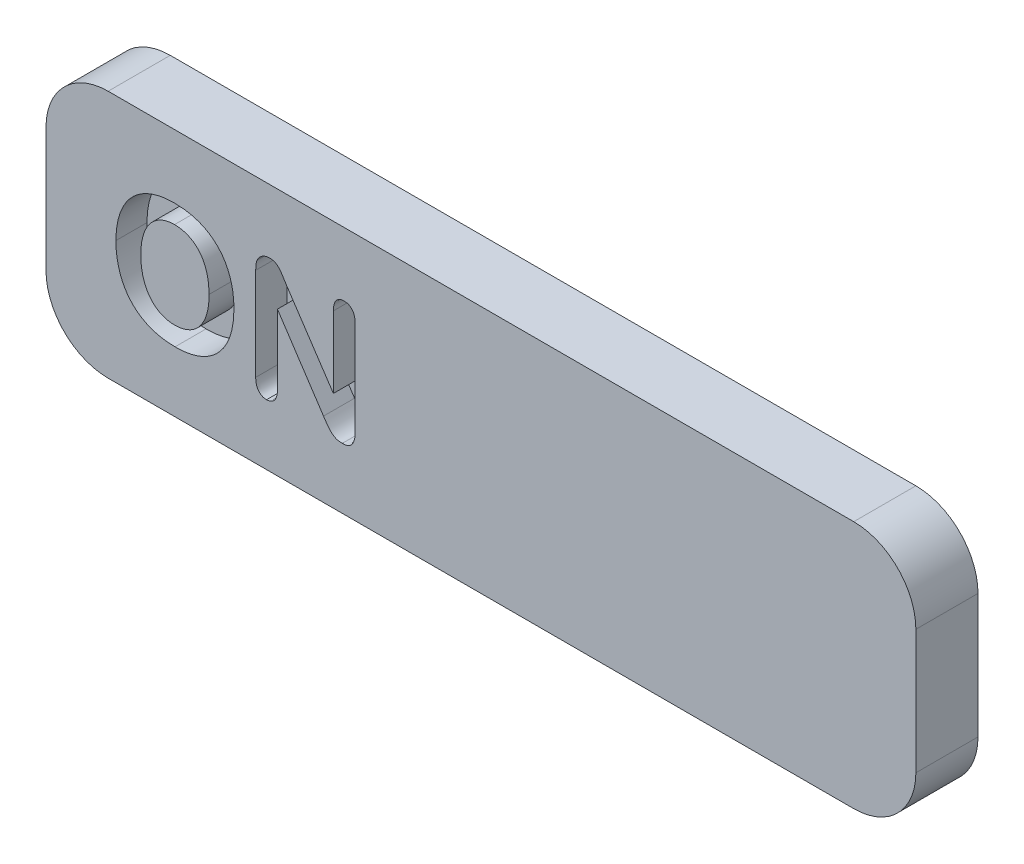
from build123d import *

# Parameters (mm, degrees)
AUFSATZ_LINEAR_AUSTRAGEN1_DEPTH = 1
SCHNITT_LINEAR_AUSTRAGEN1_DEPTH = 0.5


with BuildPart() as part:
    # Skizze1 → Aufsatz-Linear austragen1 (new body)
    with BuildSketch(Plane.XY):
        with BuildLine():
            Line((1, 0), (13, 0))
            ThreePointArc((13, 0), (13.707106781, 0.292893219), (14, 1))
            Line((14, 1), (14, 3))
            ThreePointArc((14, 3), (13.707106781, 3.707106781), (13, 4))
            Line((13, 4), (1, 4))
            ThreePointArc((1, 4), (0.292893219, 3.707106781), (0, 3))
            Line((0, 3), (0, 1))
            ThreePointArc((0, 1), (0.292893219, 0.292893219), (1, 0))
        make_face()
    extrude(amount=AUFSATZ_LINEAR_AUSTRAGEN1_DEPTH)

    # Skizze2 → Schnitt-Linear austragen1 (cut)
    # profile 1 of 2: a face of its own
    with BuildSketch(Plane.XY.offset(1)):
        with BuildLine():
            add(Edge.make_bspline(
                [(2.068359375, 2.975), (2.093112394, 2.974652516), (2.14164836, 2.973971167), (2.213088792, 2.96779492), (2.281989676, 2.95862748), (2.348304365, 2.945431971), (2.411868349, 2.928213747), (2.472693733, 2.90705225), (2.530858895, 2.882017573), (2.586431863, 2.853600887), (2.638802164, 2.821433292), (2.688303235, 2.786256364), (2.73437439, 2.747554036), (2.77712302, 2.705666037), (2.816276383, 2.660478074), (2.852403686, 2.612241049), (2.885226635, 2.56068362), (2.914391718, 2.505816744), (2.940594574, 2.44846024), (2.963340406, 2.388446006), (2.982324979, 2.326028293), (2.998116048, 2.26110371), (3.010084082, 2.193767278), (3.018514176, 2.123861297), (3.024350356, 2.051661497), (3.024781349, 2.002616087), (3.025, 1.977734375)],
                knots=[0, 0, 0, 0, 1.137132438, 2.22970057, 3.292424762, 4.329649132, 5.333981859, 6.315987487, 7.286185149, 8.241436353, 9.181332131, 10.107725602, 11.0292572, 11.943085262, 12.854854597, 13.773819033, 14.709898734, 15.660115542, 16.626635295, 17.605574315, 18.606712189, 19.622473761, 20.67399022, 21.747038223, 22.857027702, 24, 24, 24, 24], degree=3))
            add(Edge.make_bspline(
                [(3.025, 1.977734375), (3.024236943, 1.941248344), (3.022739737, 1.869658489), (3.011382941, 1.76485224), (2.992130943, 1.66508578), (2.965911152, 1.570399581), (2.931448688, 1.481449161), (2.889521373, 1.398351336), (2.839716722, 1.321507209), (2.782571307, 1.250986245), (2.718303636, 1.18718792), (2.646474639, 1.13157047), (2.567529745, 1.084100864), (2.48217021, 1.044116269), (2.38988477, 1.012613038), (2.290860282, 0.991433257), (2.185708374, 0.977018048), (2.11333274, 0.975684634), (2.076171875, 0.975)],
                knots=[0, 0, 0, 0, 1.119700056, 2.196982321, 3.230778928, 4.235358115, 5.208318876, 6.153781848, 7.087131445, 8.013361148, 8.934611457, 9.860297843, 10.794468433, 11.756326826, 12.748403726, 13.780058436, 14.860183413, 16, 16, 16, 16], degree=3))
            add(Edge.make_bspline(
                [(2.076171875, 0.975), (2.03927875, 0.975888232), (1.967053764, 0.977627108), (1.861766869, 0.991561146), (1.762215291, 1.013976035), (1.668967416, 1.04602514), (1.582674595, 1.08683826), (1.502975001, 1.134344554), (1.431414901, 1.190464862), (1.367075118, 1.253597267), (1.309960779, 1.323841341), (1.261404629, 1.401545242), (1.218582067, 1.485017774), (1.184733705, 1.575497068), (1.157803717, 1.671020204), (1.13882396, 1.770875151), (1.127251689, 1.874465923), (1.125758488, 1.944761386), (1.125, 1.98046875)],
                knots=[0, 0, 0, 0, 1.130091603, 2.212359386, 3.247930852, 4.252250901, 5.226719473, 6.16821431, 7.089197795, 8.00610207, 8.925165125, 9.855999165, 10.808795857, 11.79501972, 12.810514548, 13.846493258, 14.906102224, 16, 16, 16, 16], degree=3))
            add(Edge.make_bspline(
                [(1.125, 1.98046875), (1.125688028, 2.016832883), (1.127040936, 2.088337779), (1.139531744, 2.193099625), (1.15925301, 2.293397724), (1.187362441, 2.388727145), (1.223002781, 2.478418194), (1.266262664, 2.561492737), (1.316348518, 2.637693274), (1.373591781, 2.70687478), (1.438083357, 2.768616063), (1.509462446, 2.82261175), (1.587377693, 2.86905948), (1.671832678, 2.907263474), (1.762443164, 2.937927219), (1.859185583, 2.959576748), (1.961878055, 2.97269235), (2.032251673, 2.974217478), (2.068359375, 2.975)],
                knots=[0, 0, 0, 0, 1.125218611, 2.212582392, 3.260701818, 4.286054269, 5.284468473, 6.243521648, 7.180287843, 8.101949555, 9.017004541, 9.937572836, 10.866572707, 11.818894766, 12.801573564, 13.82236102, 14.882684417, 16, 16, 16, 16], degree=3))
        make_face()
        with BuildLine():
            add(Edge.make_bspline(
                [(2.625, 1.98046875), (2.624236115, 2.015277472), (2.622757058, 2.082675226), (2.609648511, 2.180171038), (2.588416712, 2.27060321), (2.563111057, 2.340625009), (2.538811369, 2.392528468), (2.51896586, 2.42865343), (2.497617935, 2.462663361), (2.473388511, 2.493425176), (2.448255174, 2.522406317), (2.421043849, 2.54892338), (2.391707134, 2.572581535), (2.350596581, 2.601296683), (2.295234429, 2.631050621), (2.223753123, 2.656546627), (2.147556711, 2.672258276), (2.09512819, 2.674073293), (2.068359375, 2.675)],
                knots=[0, 0, 0, 0, 1.663767962, 3.22144036, 4.693807908, 6.09809827, 6.772124886, 7.43249818, 8.068074837, 8.689496673, 9.30272399, 9.901527182, 10.503429657, 11.102750509, 12.297797107, 13.495176895, 14.721094103, 16, 16, 16, 16], degree=3))
            add(Edge.make_bspline(
                [(2.068359375, 2.675), (2.04918449, 2.674523021), (2.011287158, 2.673580316), (1.955655243, 2.664627547), (1.902215528, 2.650626376), (1.851216647, 2.631043473), (1.803112784, 2.606035103), (1.758119138, 2.575673263), (1.716778265, 2.540076152), (1.678858763, 2.499387916), (1.64458724, 2.453198562), (1.614182017, 2.401028966), (1.587690016, 2.342878426), (1.565104568, 2.279265806), (1.547241689, 2.210518214), (1.534540277, 2.137356433), (1.526561269, 2.060201883), (1.525528163, 2.007441739), (1.525, 1.98046875)],
                knots=[0, 0, 0, 0, 0.926902171, 1.831933723, 2.71800685, 3.595261319, 4.468550136, 5.334998465, 6.214894287, 7.1017058, 8.020008637, 8.99111482, 10.01694856, 11.106630737, 12.25237115, 13.448355624, 14.695502513, 16, 16, 16, 16], degree=3))
            add(Edge.make_bspline(
                [(1.525, 1.98046875), (1.525529621, 1.953235833), (1.526565779, 1.899956987), (1.534528502, 1.822019496), (1.547312827, 1.74796955), (1.565048146, 1.678113625), (1.58799262, 1.613266121), (1.615536195, 1.554021234), (1.646413772, 1.499956378), (1.682840272, 1.452579062), (1.722186978, 1.410770889), (1.76447307, 1.374356244), (1.809393417, 1.343334803), (1.857378179, 1.318080366), (1.908164293, 1.299131658), (1.961190349, 1.284770984), (2.016800589, 1.276568573), (2.054661701, 1.275527183), (2.073828125, 1.275)],
                knots=[0, 0, 0, 0, 1.300369924, 2.54406124, 3.737115199, 4.88637188, 5.981883645, 7.016846829, 8.003376514, 8.948590554, 9.863559023, 10.741055788, 11.608647785, 12.46534091, 13.323432129, 14.192248925, 15.0848625, 16, 16, 16, 16], degree=3))
            add(Edge.make_bspline(
                [(2.073828125, 1.275), (2.098514049, 1.275826804), (2.147153697, 1.277455889), (2.218375005, 1.292666561), (2.286422084, 1.316581814), (2.340300617, 1.34411813), (2.380907534, 1.371243102), (2.410251531, 1.394127245), (2.437531132, 1.420168305), (2.463533565, 1.448361043), (2.487628227, 1.479320201), (2.510440944, 1.51265316), (2.531503359, 1.54871627), (2.550989754, 1.587307904), (2.568587312, 1.628357856), (2.583936454, 1.67175711), (2.596172475, 1.717696454), (2.606851743, 1.765749251), (2.614975974, 1.816231574), (2.620753103, 1.868901619), (2.624372846, 1.923907557), (2.624787704, 1.961322387), (2.625, 1.98046875)],
                knots=[0, 0, 0, 0, 1.468568495, 2.893578421, 4.316075305, 5.755382189, 6.482330971, 7.222315454, 7.968369796, 8.725783183, 9.504530818, 10.302500265, 11.129737207, 11.9897977, 12.875655565, 13.787998707, 14.728608307, 15.705132475, 16.718642732, 17.771954593, 18.859838044, 20, 20, 20, 20], degree=3))
        make_face(mode=Mode.SUBTRACT)
    # profile 2 of 2: a face of its own
    with BuildSketch(Plane.XY.offset(1)):
        with BuildLine():
            Line((3.86484375, 2.740234375), (4.625, 1.6))
            Line((4.625, 1.6), (4.625, 2.75078125))
            add(Edge.make_bspline(
                [(4.625, 2.75078125), (4.625586836, 2.768395927), (4.626686005, 2.801389002), (4.635036402, 2.847648409), (4.649668068, 2.886889392), (4.670402191, 2.919114128), (4.696180986, 2.944318069), (4.726619023, 2.962223197), (4.761117632, 2.973196011), (4.785463851, 2.974385321), (4.798046875, 2.975)],
                knots=[0, 0, 0, 0, 1.319117216, 2.470765316, 3.505116792, 4.43580569, 5.318756254, 6.18027265, 7.059497782, 8, 8, 8, 8], degree=3))
            add(Edge.make_bspline(
                [(4.798046875, 2.975), (4.811012753, 2.974373778), (4.836109378, 2.97316167), (4.871600638, 2.962412213), (4.902620124, 2.944321241), (4.928806854, 2.919151114), (4.949918941, 2.886925272), (4.965064382, 2.847732261), (4.973280664, 2.80137765), (4.974401563, 2.768391976), (4.975, 2.75078125)],
                knots=[0, 0, 0, 0, 0.959871134, 1.857917088, 2.719075999, 3.600089629, 4.526699118, 5.554128738, 6.694173474, 8, 8, 8, 8], degree=3))
            Line((4.975, 2.75078125), (4.975, 1.2296875))
            add(Edge.make_bspline(
                [(4.975, 1.2296875), (4.974517449, 1.209721265), (4.973611757, 1.172246954), (4.963962629, 1.119848054), (4.947690056, 1.075246898), (4.924922255, 1.038240953), (4.894956518, 1.009207633), (4.857911429, 0.989251615), (4.814719484, 0.976787702), (4.783815821, 0.975615768), (4.767578125, 0.975)],
                knots=[0, 0, 0, 0, 1.276164049, 2.395212213, 3.391561633, 4.297456637, 5.151673506, 6.027862746, 6.963780962, 8, 8, 8, 8], degree=3))
            add(Edge.make_bspline(
                [(4.767578125, 0.975), (4.751115635, 0.975772416), (4.719363897, 0.977262199), (4.673622221, 0.988138948), (4.632032835, 1.008430687), (4.594663962, 1.037771284), (4.55968076, 1.073356467), (4.527659202, 1.11463191), (4.497490318, 1.159350157), (4.476842172, 1.189466295), (4.46640625, 1.2046875)],
                knots=[0, 0, 0, 0, 0.990229924, 1.909888509, 2.806876858, 3.75171819, 4.754420985, 5.802993103, 6.889595585, 8, 8, 8, 8], degree=3))
            Line((4.46640625, 1.2046875), (3.725, 2.325))
            Line((3.725, 2.325), (3.725, 1.198046875))
            add(Edge.make_bspline(
                [(3.725, 1.198046875), (3.724414523, 1.180824483), (3.72330548, 1.148200888), (3.714742096, 1.102326501), (3.698988566, 1.0631574), (3.677344387, 1.0309462), (3.650765302, 1.005883739), (3.620379665, 0.987840533), (3.586282235, 0.976836674), (3.562322205, 0.975623773), (3.55, 0.975)],
                knots=[0, 0, 0, 0, 1.293064309, 2.449392962, 3.484384031, 4.441729672, 5.340986808, 6.204611779, 7.076664708, 8, 8, 8, 8], degree=3))
            add(Edge.make_bspline(
                [(3.55, 0.975), (3.537415957, 0.975600427), (3.512903847, 0.976769981), (3.478206619, 0.988073985), (3.447689985, 1.006729195), (3.421040174, 1.031933145), (3.400304093, 1.064751921), (3.385493226, 1.103922858), (3.376597599, 1.149477245), (3.375553408, 1.181988306), (3.375, 1.19921875)],
                knots=[0, 0, 0, 0, 0.938889884, 1.828837584, 2.693878765, 3.596100726, 4.546832571, 5.570326044, 6.712304089, 8, 8, 8, 8], degree=3))
            Line((3.375, 1.19921875), (3.375, 2.69140625))
            add(Edge.make_bspline(
                [(3.375, 2.69140625), (3.37514655, 2.706394453), (3.375423663, 2.734735734), (3.379522399, 2.774642207), (3.385123318, 2.80976372), (3.392066316, 2.830792867), (3.3953125, 2.840625)],
                knots=[0, 0, 0, 0, 1.18793306, 2.246269525, 3.180047019, 4, 4, 4, 4], degree=3))
            add(Edge.make_bspline(
                [(3.3953125, 2.840625), (3.399668454, 2.850192085), (3.408364875, 2.869292239), (3.427434086, 2.894600683), (3.449198834, 2.91818821), (3.475465064, 2.937620764), (3.503805632, 2.954136488), (3.533862342, 2.966343001), (3.565275925, 2.973670728), (3.5865505, 2.974554753), (3.597265625, 2.975)],
                knots=[0, 0, 0, 0, 0.980600708, 1.957714689, 2.948627098, 3.97434472, 5.000279326, 6.011426356, 6.998437519, 8, 8, 8, 8], degree=3))
            add(Edge.make_bspline(
                [(3.597265625, 2.975), (3.613277137, 2.974362991), (3.643301645, 2.973168483), (3.684701728, 2.959340883), (3.719945443, 2.939070857), (3.750422654, 2.911403027), (3.779239652, 2.877209196), (3.805947743, 2.835053519), (3.834869484, 2.788741916), (3.854699923, 2.756650193), (3.86484375, 2.740234375)],
                knots=[0, 0, 0, 0, 1.01695463, 1.906975685, 2.751376853, 3.592506721, 4.517315556, 5.594915983, 6.76973195, 8, 8, 8, 8], degree=3))
        make_face()
    extrude(amount=-SCHNITT_LINEAR_AUSTRAGEN1_DEPTH, mode=Mode.SUBTRACT)


solid = part.part
